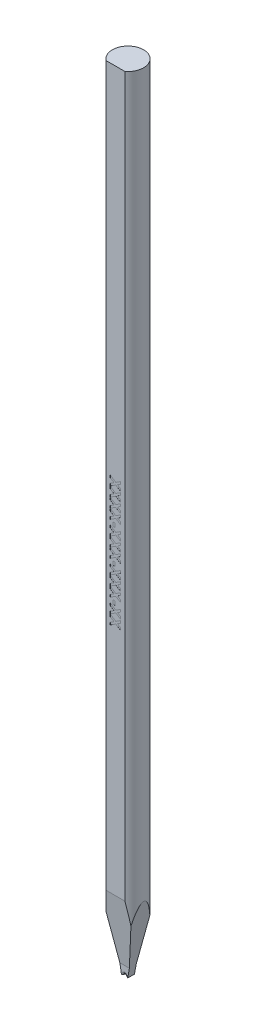
from build123d import *

# Parameters (mm, degrees)
SKETCH_TL_CUTTING_R       = 1.4986
TL_CUTTING_DEPTH          = 75.9968
SKETCH_TDF_GRINDING_W     = 3.0172
SKETCH_TDF_GRINDING_H     = 3.0172
TDF_GRINDING_DEPTH        = 77.026345527
SKETCH_ENGRAVING_W        = 0.166666667
SKETCH_ENGRAVING_H        = 0.371794872
ENGRAVING_DEPTH           = 0.005
VW_VR_GRINDING_DEPTH      = 1.5086
VW_VR_GRINDING_DEPTH_BACK = 1.5086
ISA_GRINDING_DEPTH        = 1.5086
ISA_GRINDING_DEPTH_BACK   = 1.5086
PRE_FRX_BRX_DEPTH         = 1.5086
PRE_FRX_BRX_DEPTH_BACK    = 1.5086
SKETCH_PRE_FRX_BRX_W      = 1.18348
SKETCH_PRE_FRX_BRX_H      = 0.889
FR_EDM_R                  = 0.14986
BR_EDM_R                  = 0.14986
FA_BA_GRINDING_DEPTH      = 1.5086
FA_BA_GRINDING_DEPTH_BACK = 1.5086


with BuildPart() as part:
    # sketch_TL_cutting → TL_cutting (new body)
    with BuildSketch(Plane(origin=(0, 0, 0), x_dir=(1, 0, 0), z_dir=(0, 1, 0))):
        Circle(SKETCH_TL_CUTTING_R)
    extrude(amount=TL_CUTTING_DEPTH)

    # sketch_TDF_grinding → TDF_grinding (cut, through all)
    with BuildSketch(Plane(origin=(0, 0, 0), x_dir=(1, 0, 0), z_dir=(0, 1, 0))):
        with Locations((0, -2.71002)):
            Rectangle(SKETCH_TDF_GRINDING_W, SKETCH_TDF_GRINDING_H)
    extrude(amount=TDF_GRINDING_DEPTH, mode=Mode.SUBTRACT)

    # sketch_engraving → engraving (cut)
    with BuildSketch(Plane.XY.offset(1.20142)):
        Polygon((-0.5, 41.791829744), (0.029647436, 41.449081346), (0.5, 41.753368205), (0.5, 41.52860859), (0.203325321, 41.336701538), (0.5, 41.144794487), (0.5, 40.920034872), (0.029647436, 41.224321731), (-0.5, 40.881573333), (-0.5, 41.106332949), (-0.144030449, 41.336701538), (-0.5, 41.567070128), align=None)
        Polygon((-0.5, 40.868752821), (0.029647436, 40.526004423), (0.5, 40.830291282), (0.5, 40.605531667), (0.203325321, 40.413624615), (0.5, 40.221717564), (0.5, 39.996957949), (0.029647436, 40.301244808), (-0.5, 39.95849641), (-0.5, 40.183256026), (-0.144030449, 40.413624615), (-0.5, 40.643993205), align=None)
        Polygon((-0.5, 39.945675897), (0.029647436, 39.6029275), (0.5, 39.907214359), (0.5, 39.682454744), (0.203325321, 39.490547692), (0.5, 39.298640641), (0.5, 39.073881026), (0.029647436, 39.378167885), (-0.5, 39.035419487), (-0.5, 39.260179103), (-0.144030449, 39.490547692), (-0.5, 39.720916282), align=None)
        Polygon((-0.5, 39.022598974), (0.029647436, 38.679850577), (0.5, 38.984137436), (0.5, 38.759377821), (0.203325321, 38.567470769), (0.5, 38.375563718), (0.5, 38.150804103), (0.029647436, 38.455090962), (-0.5, 38.112342564), (-0.5, 38.337102179), (-0.144030449, 38.567470769), (-0.5, 38.797839359), align=None)
        with Locations((-0.147435898, 37.843111795)):
            Rectangle(SKETCH_ENGRAVING_W, SKETCH_ENGRAVING_H)
        Polygon((-0.5, 37.63798359), (0.029647436, 37.295235192), (0.5, 37.599522051), (0.5, 37.374762436), (0.203325321, 37.182855385), (0.5, 36.990948333), (0.5, 36.766188718), (0.029647436, 37.070475577), (-0.5, 36.727727179), (-0.5, 36.952486795), (-0.144030449, 37.182855385), (-0.5, 37.413223974), align=None)
        Polygon((-0.5, 36.714906667), (0.029647436, 36.372158269), (0.5, 36.676445128), (0.5, 36.451685513), (0.203325321, 36.259778462), (0.5, 36.06787141), (0.5, 35.843111795), (0.029647436, 36.147398654), (-0.5, 35.804650256), (-0.5, 36.029409872), (-0.144030449, 36.259778462), (-0.5, 36.490147051), align=None)
        Polygon((-0.5, 35.791829744), (0.029647436, 35.449081346), (0.5, 35.753368205), (0.5, 35.52860859), (0.203325321, 35.336701538), (0.5, 35.144794487), (0.5, 34.920034872), (0.029647436, 35.224321731), (-0.5, 34.881573333), (-0.5, 35.106332949), (-0.144030449, 35.336701538), (-0.5, 35.567070128), align=None)
        with Locations((-0.147435898, 34.612342564)):
            Rectangle(SKETCH_ENGRAVING_W, SKETCH_ENGRAVING_H)
        Polygon((-0.5, 34.407214359), (0.029647436, 34.064465962), (0.5, 34.368752821), (0.5, 34.143993205), (0.203325321, 33.952086154), (0.5, 33.760179103), (0.5, 33.535419487), (0.029647436, 33.839706346), (-0.5, 33.496957949), (-0.5, 33.721717564), (-0.144030449, 33.952086154), (-0.5, 34.182454744), align=None)
        Polygon((-0.5, 33.484137436), (0.029647436, 33.141389038), (0.5, 33.445675897), (0.5, 33.220916282), (0.203325321, 33.029009231), (0.5, 32.837102179), (0.5, 32.612342564), (0.029647436, 32.916629423), (-0.5, 32.573881026), (-0.5, 32.798640641), (-0.144030449, 33.029009231), (-0.5, 33.259377821), align=None)
        Polygon((-0.5, 32.561060513), (0.029647436, 32.218312115), (0.5, 32.522598974), (0.5, 32.297839359), (0.203325321, 32.105932308), (0.5, 31.914025256), (0.5, 31.689265641), (0.029647436, 31.9935525), (-0.5, 31.650804103), (-0.5, 31.875563718), (-0.144030449, 32.105932308), (-0.5, 32.336300897), align=None)
        with Locations((-0.147435898, 31.381573333)):
            Rectangle(SKETCH_ENGRAVING_W, SKETCH_ENGRAVING_H)
        Polygon((-0.5, 31.176445128), (0.029647436, 30.833696731), (0.5, 31.13798359), (0.5, 30.913223974), (0.203325321, 30.721316923), (0.5, 30.529409872), (0.5, 30.304650256), (0.029647436, 30.608937115), (-0.5, 30.266188718), (-0.5, 30.490948333), (-0.144030449, 30.721316923), (-0.5, 30.951685513), align=None)
        Polygon((-0.5, 30.253368205), (0.029647436, 29.910619808), (0.5, 30.214906667), (0.5, 29.990147051), (0.203325321, 29.79824), (0.5, 29.606332949), (0.5, 29.381573333), (0.029647436, 29.685860192), (-0.5, 29.343111795), (-0.5, 29.56787141), (-0.144030449, 29.79824), (-0.5, 30.02860859), align=None)
    extrude(amount=-ENGRAVING_DEPTH, mode=Mode.SUBTRACT)

    # sketch_VW_VR_grinding → VW_VR_grinding (cut, two sides: drawn at the far end of the back side and taken through both)
    with BuildSketch(Plane.XY.offset(-VW_VR_GRINDING_DEPTH_BACK)):
        with BuildLine():
            Line((-1.4936, -0.01), (-1.4936, 0.874))
            ThreePointArc((-1.4936, 0.874), (-1.495064466, 0.877535534), (-1.4986, 0.879))
            Line((-1.4986, 0.879), (-1.5086, 0.879))
            Line((-1.5086, 0.879), (-1.5086, -0.01))
            Line((-1.5086, -0.01), (-1.4936, -0.01))
        make_face()
        with BuildLine():
            Line((1.4936, -0.01), (1.4936, 0.874))
            ThreePointArc((1.4936, 0.874), (1.495064466, 0.877535534), (1.4986, 0.879))
            Line((1.4986, 0.879), (1.5086, 0.879))
            Line((1.5086, 0.879), (1.5086, -0.01))
            Line((1.5086, -0.01), (1.4936, -0.01))
        make_face()
    extrude(amount=VW_VR_GRINDING_DEPTH + VW_VR_GRINDING_DEPTH_BACK, mode=Mode.SUBTRACT)

    # sketch_ISA_grinding → ISA_grinding (cut, two sides: drawn at the far end of the back side and taken through both)
    with BuildSketch(Plane.XY.offset(-ISA_GRINDING_DEPTH_BACK)):
        Polygon((-0.29972, 0), (-1.5086, 6.855899166), (-1.5086, -0.01), (1.5086, -0.01), (1.5086, 6.855899166), (0.29972, 0), align=None)
    extrude(amount=ISA_GRINDING_DEPTH + ISA_GRINDING_DEPTH_BACK, mode=Mode.SUBTRACT)

    # sketch_pre_FRX_BRX → pre_FRX_BRX (cut, two sides: drawn at the far end of the back side and taken through both)
    with BuildSketch(Plane(origin=(0, 0, 0), x_dir=(0, 0, -1), z_dir=(1, 0, 0)).offset(-PRE_FRX_BRX_DEPTH_BACK)):
        with Locations((-0.91686, 0.4345)):
            Rectangle(SKETCH_PRE_FRX_BRX_W, SKETCH_PRE_FRX_BRX_H)
        with Locations((0.91686, 0.4345)):
            Rectangle(SKETCH_PRE_FRX_BRX_W, SKETCH_PRE_FRX_BRX_H)
    extrude(amount=PRE_FRX_BRX_DEPTH + PRE_FRX_BRX_DEPTH_BACK, mode=Mode.SUBTRACT)

    # V-Groove_EDM: sweep along a path in sketch_contour_V-Groove
    with BuildLine(Plane(origin=(0, 0, 0), x_dir=(0, 0, -1), z_dir=(1, 0, 0))) as v_groove_edm_path:
        Line((-1.20142, 0.1905), (0, 0.1905))
        Line((0, 0.1905), (1.4986, 0.1905))
    # sketch_section_V-Groove → V-Groove_EDM (sweep, cut)
    with BuildSketch(Plane.XY.offset(1.20142)):
        with BuildLine():
            Line((-1.49899536, -1.905), (-0.049898839, 0.164524309))
            ThreePointArc((-0.049898839, 0.164524309), (0, 0.1905), (0.049898839, 0.164524309))
            Line((0.049898839, 0.164524309), (1.49899536, -1.905))
            Line((1.49899536, -1.905), (-1.49899536, -1.905))
        make_face()
    sweep(path=v_groove_edm_path.line, mode=Mode.SUBTRACT)

    # FR_EDM
    fr_edm_edges = [part.edges().sort_by_distance(p)[0] for p in [
        (0.107499419, 0.082262154, 0.32512),
        (0, 0.1905, 0.32512),
        (-0.107499419, 0.082262154, 0.32512),
    ]]
    fillet(fr_edm_edges, radius=FR_EDM_R)

    # BR_EDM
    br_edm_edges = [part.edges().sort_by_distance(p)[0] for p in [
        (0.107499419, 0.082262154, -0.32512),
        (0, 0.1905, -0.32512),
        (-0.107499419, 0.082262154, -0.32512),
    ]]
    fillet(br_edm_edges, radius=BR_EDM_R)

    # sketch_FA_BA_grinding → FA_BA_grinding (cut, two sides: drawn at the far end of the back side and taken through both)
    with BuildSketch(Plane(origin=(0, 0, 0), x_dir=(0, 0, -1), z_dir=(1, 0, 0)).offset(-FA_BA_GRINDING_DEPTH_BACK)):
        Polygon((2.4986, 16.354113784), (2.4986, -0.1), (0.32512, -0.1), (0.32512, 0.889), align=None)
        Polygon((-3.272828656, 21.863036919), (-0.32512, 0.889), (-0.32512, -0.1), (-3.272828656, -0.1), align=None)
    extrude(amount=FA_BA_GRINDING_DEPTH + FA_BA_GRINDING_DEPTH_BACK, mode=Mode.SUBTRACT)


solid = part.part
